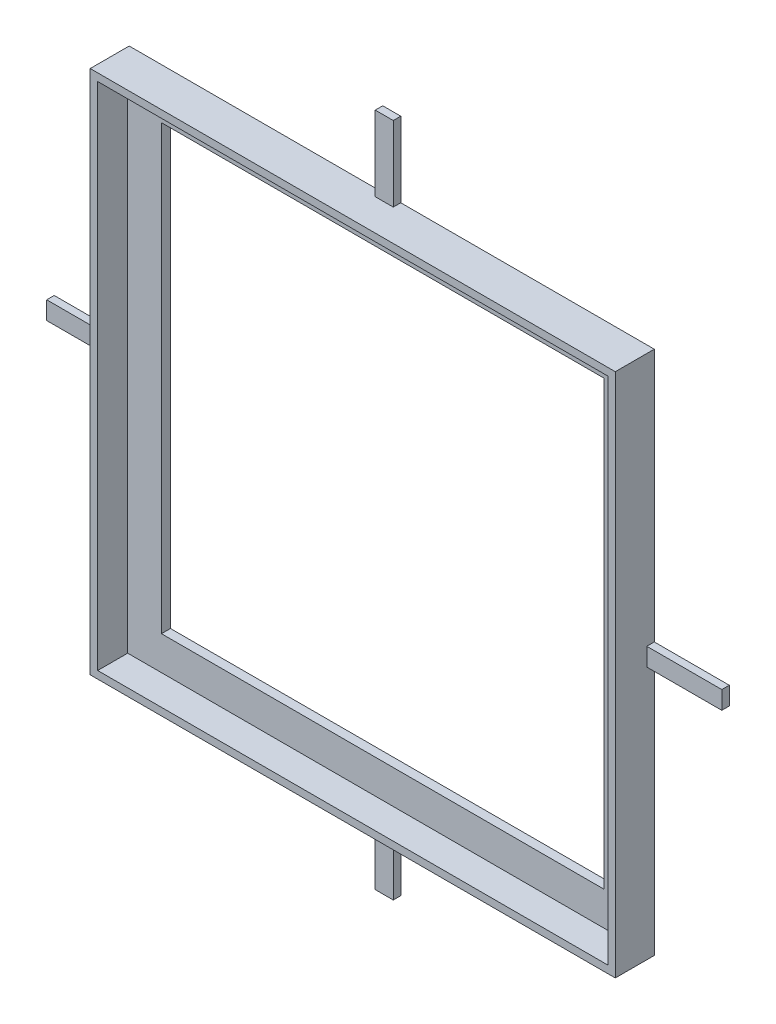
from build123d import *

# Parameters (mm, degrees)
ESQUISSE1_W             = 350
ESQUISSE1_H             = 350
BOSS_EXTRU_1_DEPTH      = 26
ESQUISSE2_W             = 340
ESQUISSE2_H             = 340
ESQUISSE2_W_2           = 295
ESQUISSE2_H_2           = 295
ENL_V_MAT_EXTRU_1_DEPTH = 20
ESQUISSE3_W             = 295
ESQUISSE3_H             = 295
ENL_V_MAT_EXTRU_2_DEPTH = 249.849352018
ESQUISSE4_W             = 50
ESQUISSE4_H             = 12
ESQUISSE4_W_2           = 12
ESQUISSE4_H_2           = 50
BOSS_EXTRU_2_DEPTH      = 5


with BuildPart() as part:
    # Esquisse1 → Boss.-Extru.1 (new body)
    with BuildSketch(Plane.XY):
        Rectangle(ESQUISSE1_W, ESQUISSE1_H)
    extrude(amount=BOSS_EXTRU_1_DEPTH)

    # Esquisse2 → Enlèv. mat.-Extru.1 (cut)
    with BuildSketch(Plane.XY.offset(26)):
        Rectangle(ESQUISSE2_W, ESQUISSE2_H)
        Rectangle(ESQUISSE2_W_2, ESQUISSE2_H_2, mode=Mode.SUBTRACT)
    extrude(amount=-ENL_V_MAT_EXTRU_1_DEPTH, mode=Mode.SUBTRACT)

    # Esquisse3 → Enlèv. mat.-Extru.2 (cut, through all)
    with BuildSketch(Plane.XY.offset(26)):
        Rectangle(ESQUISSE3_W, ESQUISSE3_H)
    extrude(amount=-ENL_V_MAT_EXTRU_2_DEPTH, mode=Mode.SUBTRACT)

    # Esquisse4 → Boss.-Extru.2 (add)
    with BuildSketch(Plane.XY):
        with Locations((-200, 0)):
            Rectangle(ESQUISSE4_W, ESQUISSE4_H)
        with Locations((200, 0)):
            Rectangle(ESQUISSE4_W, ESQUISSE4_H)
        with Locations((0, 200)):
            Rectangle(ESQUISSE4_W_2, ESQUISSE4_H_2)
        with Locations((0, -200)):
            Rectangle(ESQUISSE4_W_2, ESQUISSE4_H_2)
    extrude(amount=BOSS_EXTRU_2_DEPTH)


solid = part.part
